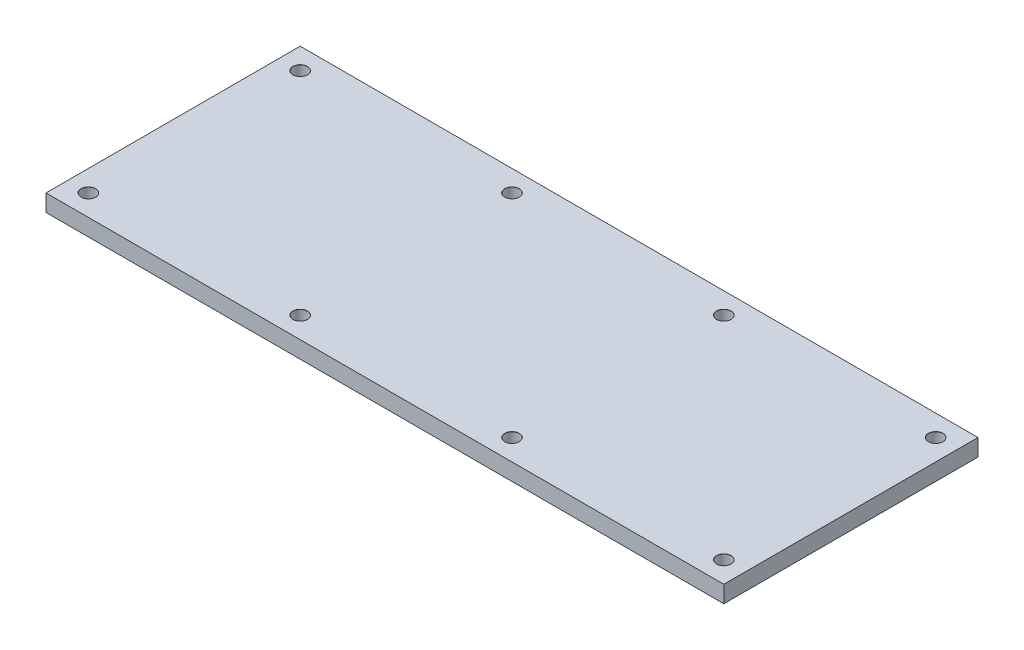
from build123d import *

# Parameters (mm, degrees)
SKETCH1_W                      = 160
SKETCH1_H                      = 60
BOSS_EXTRUDE1_DEPTH            = 4
M3_CLEARANCE_HOLE1_D           = 3.4
M3_CLEARANCE_HOLE1_CSINK_D     = 3.45
M3_CLEARANCE_HOLE1_CSINK_ANGLE = 90


with BuildPart() as part:
    # Sketch1 → Boss-Extrude1 (new body)
    with BuildSketch(Plane(origin=(0, 0, 0), x_dir=(1, 0, 0), z_dir=(0, 1, 0))):
        with Locations((80, 30)):
            Rectangle(SKETCH1_W, SKETCH1_H)
    extrude(amount=BOSS_EXTRUDE1_DEPTH)

    # M3 Clearance Hole1 (through all)
    with Locations(Plane(origin=(0, 4, 0), x_dir=(1, 0, 0), z_dir=(0, 1, 0))):
        with Locations((155, 55), (5, 5), (55, 5), (105, 5), (155, 5), (5, 55), (55, 55), (105, 55)):
            CounterSinkHole(M3_CLEARANCE_HOLE1_D / 2, M3_CLEARANCE_HOLE1_CSINK_D / 2, counter_sink_angle=M3_CLEARANCE_HOLE1_CSINK_ANGLE)


solid = part.part
